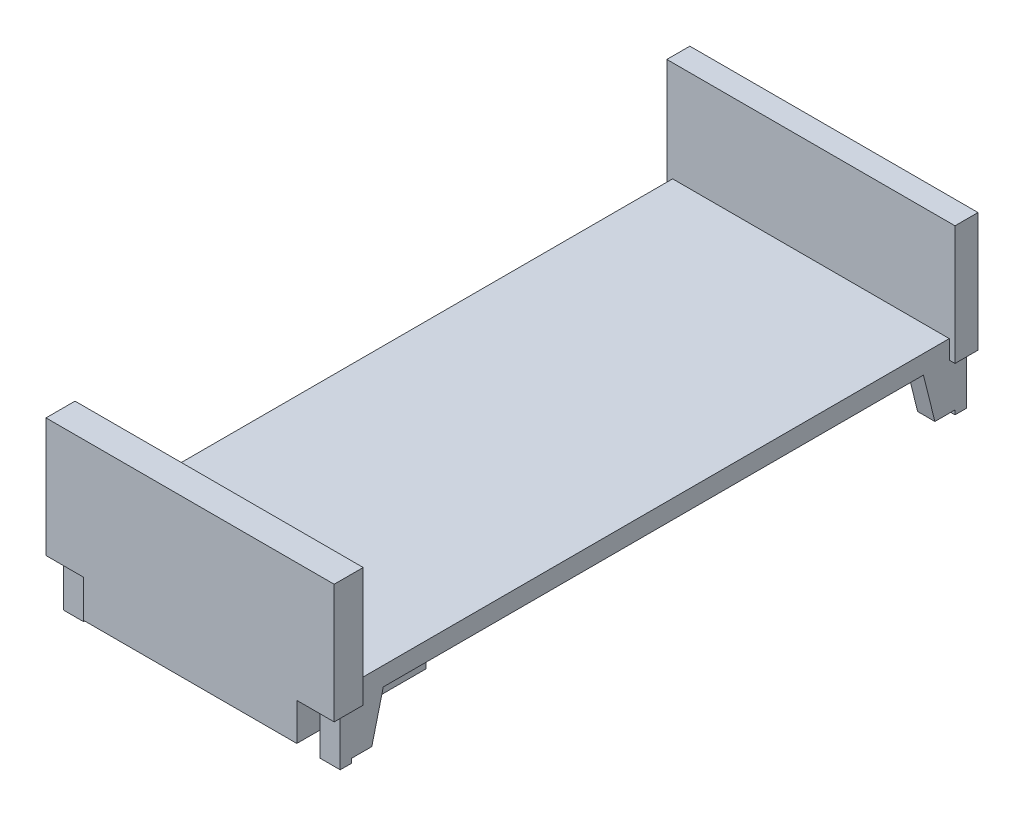
from build123d import *

# Parameters (mm, degrees)
BOSS_EXTRUDE1_DEPTH      = 65
BOSS_EXTRUDE2_DEPTH      = 350
BOSS_EXTRUDE2_DEPTH_BACK = 50
SKETCH1_3_W              = 943
SKETCH1_3_H              = 80
SKETCH1_3_H_2            = 101
SKETCH1_4_W              = 40
SKETCH1_4_H              = 40
BOSS_EXTRUDE3_DEPTH      = 240
BOSS_EXTRUDE4_DEPTH      = 30
BOSS_EXTRUDE5_DEPTH      = 30
SKETCH5_W                = 30
SKETCH5_H                = 30
CUT_EXTRUDE1_DEPTH       = 200
BOSS_EXTRUDE6_DEPTH      = 30
BOSS_EXTRUDE7_START      = -30
BOSS_EXTRUDE7_DEPTH      = 30
BOSS_EXTRUDE8_DEPTH      = 20
BOSS_EXTRUDE8_DEPTH_BACK = 20
SKETCH8_W                = 743
SKETCH8_H                = 450
BOSS_EXTRUDE9_DEPTH      = 130
BOSS_EXTRUDE14_DEPTH     = 30
BOSS_EXTRUDE15_DEPTH     = 30
BOSS_EXTRUDE16_DEPTH     = 30
BOSS_EXTRUDE17_DEPTH     = 30
BOSS_EXTRUDE18_DEPTH     = 30
BOSS_EXTRUDE19_DEPTH     = 30


with BuildPart() as part:
    # Sketch1 → Boss-Extrude1 (new body)
    with BuildSketch(Plane(origin=(0, 0, 0), x_dir=(1, 0, 0), z_dir=(0, 1, 0))):
        Polygon((-451.5, 60), (-471.5, 60), (-471.5, -41), (471.5, -41), (471.5, 60), (451.5, 60), (451.5, 2120), (471.5, 2120), (471.5, 2200), (-471.5, 2200), (-471.5, 2120), (-451.5, 2120), align=None)
    extrude(amount=-BOSS_EXTRUDE1_DEPTH)

    # Sketch1<3> → Boss-Extrude2 (add, two sides: drawn at the far end of the back side and taken through both)
    with BuildSketch(Plane(origin=(0, 0, 0), x_dir=(1, 0, 0), z_dir=(0, 1, 0)).offset(-BOSS_EXTRUDE2_DEPTH_BACK)):
        with Locations((0, 2160)):
            Rectangle(SKETCH1_3_W, SKETCH1_3_H)
        with Locations((0, 9.5)):
            Rectangle(SKETCH1_3_W, SKETCH1_3_H_2)
    extrude(amount=BOSS_EXTRUDE2_DEPTH + BOSS_EXTRUDE2_DEPTH_BACK)

    # Sketch1<4> → Boss-Extrude3 (add)
    with BuildSketch(Plane(origin=(0, 0, 0), x_dir=(1, 0, 0), z_dir=(0, 1, 0))):
        with Locations((-431.5, 20)):
            Rectangle(SKETCH1_4_W, SKETCH1_4_H)
        with Locations((431.5, 20)):
            Rectangle(SKETCH1_4_W, SKETCH1_4_H)
        with Locations((-431.5, 2160)):
            Rectangle(SKETCH1_4_W, SKETCH1_4_H)
        with Locations((431.5, 2160)):
            Rectangle(SKETCH1_4_W, SKETCH1_4_H)
    extrude(amount=-BOSS_EXTRUDE3_DEPTH)

    # Sketch3 → Boss-Extrude4 (add)
    with BuildSketch(Plane(origin=(451.5, 0, 0), x_dir=(0, 0, -1), z_dir=(1, 0, 0))):
        Polygon((40, -65), (40, -225), (110, -225), (150, -65), align=None)
        Polygon((2140, -65), (2030, -65), (2070, -225), (2140, -225), align=None)
    extrude(amount=-BOSS_EXTRUDE4_DEPTH)

    # Sketch4 → Boss-Extrude5 (add)
    with BuildSketch(Plane(origin=(-451.5, 0, -45.75), x_dir=(0, 0, -1), z_dir=(1, 0, 0))):
        Polygon((2024.25, -225), (2094.25, -225), (2094.25, -65), (1984.25, -65), align=None)
        Polygon((64.25, -225), (104.25, -65), (-5.75, -65), (-5.75, -225), align=None)
    extrude(amount=BOSS_EXTRUDE5_DEPTH)

    # Sketch5 → Cut-Extrude1 (cut)
    with BuildSketch(Plane.XZ.offset(240)):
        with Locations((-431.5, -2160)):
            Rectangle(SKETCH5_W, SKETCH5_H)
        with Locations((431.5, -2160)):
            Rectangle(SKETCH5_W, SKETCH5_H)
        with Locations((431.5, -20)):
            Rectangle(SKETCH5_W, SKETCH5_H)
        with Locations((-431.5, -20)):
            Rectangle(SKETCH5_W, SKETCH5_H)
    extrude(amount=-CUT_EXTRUDE1_DEPTH, mode=Mode.SUBTRACT)

    # Sketch6 → Boss-Extrude6 (add)
    with BuildSketch(Plane.XY.offset(41)):
        with BuildLine():
            Line((130, -65), (-130, -65))
            ThreePointArc((-130, -65), (0, -195), (130, -65))
        make_face()
    extrude(amount=-BOSS_EXTRUDE6_DEPTH)

    # Sketch7 → Boss-Extrude7 (add)
    with BuildSketch(Plane(origin=(0, 0, -2200), x_dir=(-1, 0, 0), z_dir=(0, 0, -1)).offset(BOSS_EXTRUDE7_START)):
        with BuildLine():
            Line((130, -65), (-130, -65))
            ThreePointArc((-130, -65), (0, -195), (130, -65))
        make_face()
    extrude(amount=BOSS_EXTRUDE7_DEPTH)

    # 3DSketch1 → Boss-Extrude8 (add, two sides: drawn at the far end of the back side and taken through both)
    with BuildSketch(Plane(origin=(0, -195, 11), x_dir=(0, 0.018337127203073178, -0.9998318607475651), z_dir=(1, 0, 0)).offset(-BOSS_EXTRUDE8_DEPTH_BACK)):
        Polygon((0, 0), (0.733485088, 39.99327443), (2181.366773379, 0), (2180.63328829, -39.99327443), align=None)
    extrude(amount=BOSS_EXTRUDE8_DEPTH + BOSS_EXTRUDE8_DEPTH_BACK)

    # Sketch8 → Boss-Extrude9 (add)
    with BuildSketch(Plane.XZ.offset(65)):
        with Locations((0, -184)):
            Rectangle(SKETCH8_W, SKETCH8_H)
    extrude(amount=BOSS_EXTRUDE9_DEPTH)

    # Sketch12 → Boss-Extrude14 (add)
    with BuildSketch(Plane.ZY.offset(451.5)):
        Polygon((-60, 0), (-2120, 0), (-2120, -65), (-2180, -65), (-2180, -240), (-2140, -240), (-2140, -225), (-2070, -225), (-2030, -65), (-150, -65), (-110, -225), (-40, -225), (-40, -240), (0, -240), (0, -65), (-60, -65), align=None)
    extrude(amount=BOSS_EXTRUDE14_DEPTH)

    # Sketch13 → Boss-Extrude15 (add)
    with BuildSketch(Plane(origin=(451.5, 0, 0), x_dir=(0, 0, -1), z_dir=(1, 0, 0))):
        Polygon((2120, 0), (60, 0), (60, -65), (0, -65), (0, -240), (40, -240), (40, -225), (110, -225), (150, -65), (2030, -65), (2070, -225), (2140, -225), (2140, -240), (2180, -240), (2180, -65), (2120, -65), align=None)
    extrude(amount=BOSS_EXTRUDE15_DEPTH)

    # Sketch14 → Boss-Extrude16 (add)
    with BuildSketch(Plane.ZY.offset(471.5)):
        Polygon((-2120, 350), (-2200, 350), (-2200, -65), (-2180, -65), (-2120, -65), (-2120, 0), align=None)
    extrude(amount=BOSS_EXTRUDE16_DEPTH)

    # Sketch15 → Boss-Extrude17 (add)
    with BuildSketch(Plane.ZY.offset(471.5)):
        Polygon((41, -65), (41, 350), (-60, 350), (-60, 0), (-60, -65), (0, -65), align=None)
    extrude(amount=BOSS_EXTRUDE17_DEPTH)

    # Sketch16 → Boss-Extrude18 (add)
    with BuildSketch(Plane(origin=(471.5, 0, 0), x_dir=(0, 0, -1), z_dir=(1, 0, 0))):
        Polygon((2200, 350), (2120, 350), (2120, 0), (2120, -65), (2180, -65), (2200, -65), align=None)
    extrude(amount=BOSS_EXTRUDE18_DEPTH)

    # Sketch17 → Boss-Extrude19 (add)
    with BuildSketch(Plane(origin=(471.5, 0, 0), x_dir=(0, 0, -1), z_dir=(1, 0, 0))):
        Polygon((60, -65), (60, 0), (60, 350), (-41, 350), (-41, -65), (0, -65), align=None)
    extrude(amount=BOSS_EXTRUDE19_DEPTH)


solid = part.part
